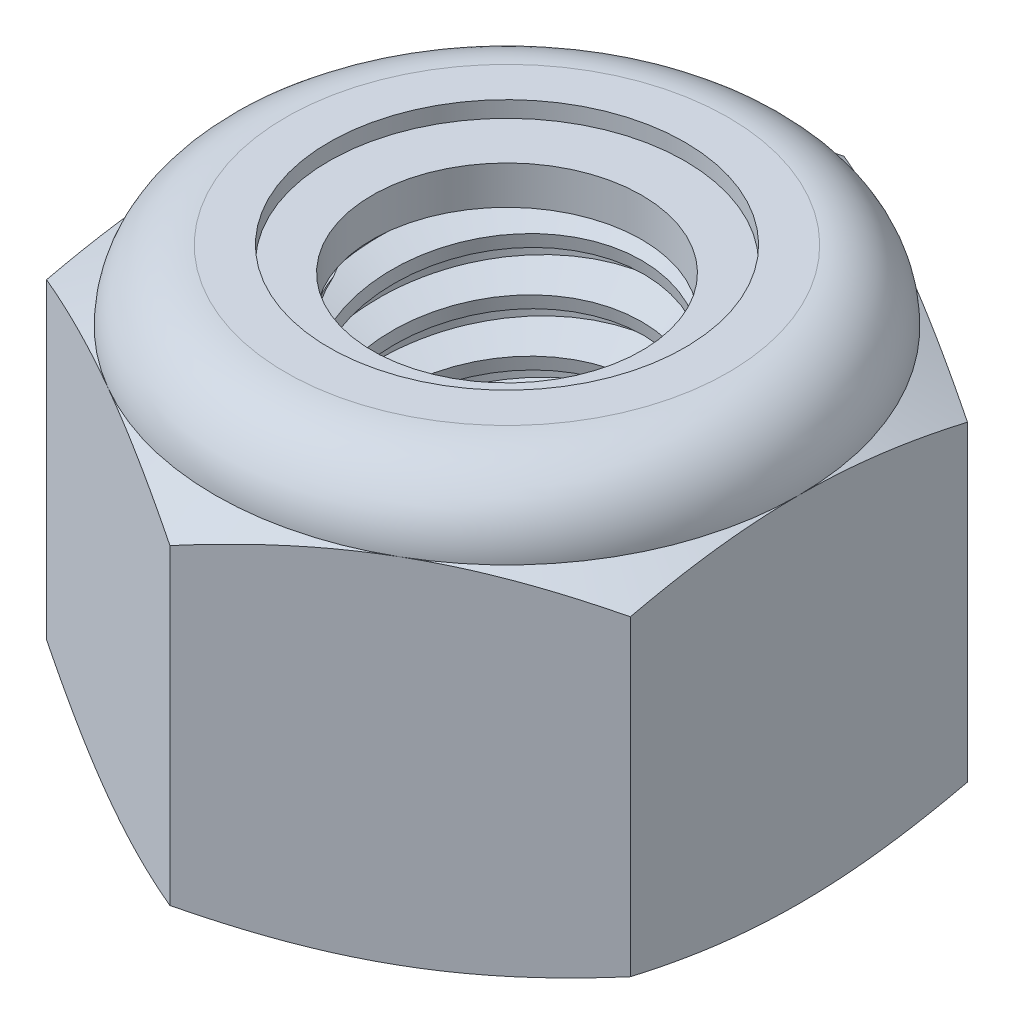
from build123d import *

# Parameters (mm, degrees)
EXTRUDE1_DEPTH      = 4
SKETCH2_W           = 1.5
SKETCH2_H           = 4
LPATTERN1_COUNT     = 8
LPATTERN1_PITCH     = 0.5
LPATTERN1_COL_COUNT = 2
LPATTERN1_COL_PITCH = 0.5


with BuildPart() as part:
    # Sketch1 → Extrude1 (new body)
    with BuildSketch(Plane(origin=(0, 0, 0), x_dir=(1, 0, 0), z_dir=(0, 1, 0))):
        Polygon((0, 3.175426481), (-2.75, 1.58771324), (-2.75, -1.58771324), (0, -3.175426481), (2.75, -1.58771324), (2.75, 1.58771324), align=None)
    extrude(amount=EXTRUDE1_DEPTH)

    # Sketch4 → Cut-Revolve2 (revolve, cut)
    with BuildSketch(Plane(origin=(0, 0, 0), x_dir=(0, 0, -1), z_dir=(1, 0, 0)), mode=Mode.PRIVATE) as cut_revolve2_sk:
        Polygon((0, 4), (1.5, 4), (1.269011592, 3.892288336), (1.269011592, 0.107711664), (1.5, 0), (0, 0), align=None)
    revolve(cut_revolve2_sk.sketch.rotate(Axis((0, 4, 0), (0, 1, 0)), 55.157981045), axis=Axis((0, 4, 0), (0, 1, 0)), mode=Mode.SUBTRACT)


with BuildPart() as body_2:
    # Sketch2 → Revolve1 (revolve)
    with BuildSketch(Plane(origin=(0, 0, 0), x_dir=(0, 0, -1), z_dir=(1, 0, 0))):
        with Locations((0.75, 2)):
            Rectangle(SKETCH2_W, SKETCH2_H)
    revolve(axis=Axis((0, -1.5, 0), (0, 1, 0)))

    # Sketch3 → Cut-Revolve1 (revolve, cut)
    with BuildSketch(Plane(origin=(0, 0, 0), x_dir=(0, 0, -1), z_dir=(1, 0, 0)), mode=Mode.PRIVATE) as cut_revolve1_sk:
        Polygon((1.510274937, 3.93835038), (1.582199494, 3.506803038), (1.289561466, 3.616435308), (1.269011592, 3.739734548), align=None)
    cut_revolve1 = revolve(cut_revolve1_sk.sketch.rotate(Axis((0, 4, 0.089188249), (0, -0.9863939238321435, -0.16439898730535837)), 180), axis=Axis((0, 4, 0.089188249), (0, -0.9863939238321435, -0.16439898730535837)), mode=Mode.SUBTRACT)

    # LPattern1: Cut-Revolve1 ×8
    with Locations(*[(0, -i * LPATTERN1_PITCH, 0) for i in range(1, LPATTERN1_COUNT)]):
        add(cut_revolve1, mode=Mode.SUBTRACT)

    # LPattern1 col: Cut-Revolve1 ×2
    with Locations(*[(0, i * LPATTERN1_COL_PITCH, 0) for i in range(1, LPATTERN1_COL_COUNT)]):
        add(cut_revolve1, mode=Mode.SUBTRACT)


with BuildPart() as part_1:
    add(part.part)

    # Combine1: cut body 2
    add(body_2.part, mode=Mode.SUBTRACT)

    # Sketch5 → Cut-Revolve3 (revolve, cut)
    with BuildSketch(Plane(origin=(0, 0, 0), x_dir=(0, 0, -1), z_dir=(1, 0, 0)), mode=Mode.PRIVATE) as cut_revolve3_sk:
        with BuildLine():
            Line((0, 0), (2.75, 0))
            Line((2.75, 0), (3.175426481, 0.198379626))
            Line((3.175426481, 0.198379626), (3.175426481, 3.134953707))
            Line((3.175426481, 3.134953707), (2.75, 3.333333333))
            ThreePointArc((2.75, 3.333333333), (2.554737854, 3.804737854), (2.083333333, 4))
            Line((2.083333333, 4), (2.083333333, 5.27))
            Line((2.083333333, 5.27), (4.445426481, 5.27))
            Line((4.445426481, 5.27), (4.445426481, -1.27))
            Line((4.445426481, -1.27), (0, -1.27))
            Line((0, -1.27), (0, 0))
        make_face()
    revolve(cut_revolve3_sk.sketch.rotate(Axis((0, 0, 0), (0, 1, 0)), 55.157981045), axis=Axis((0, 0, 0), (0, 1, 0)), mode=Mode.SUBTRACT)

    # Sketch6 → Cut-Revolve4 (revolve, cut)
    with BuildSketch(Plane(origin=(0, 0, 0), x_dir=(0, 0, -1), z_dir=(1, 0, 0)), mode=Mode.PRIVATE) as cut_revolve4_sk:
        with BuildLine():
            Line((0, 3.333333333), (2.5976, 3.333333333))
            ThreePointArc((2.5976, 3.333333333), (2.446974781, 3.696974781), (2.083333333, 3.8476))
            Line((2.083333333, 3.8476), (1.676172463, 3.8476))
            Line((1.676172463, 3.8476), (1.676172463, 5.27))
            Line((1.676172463, 5.27), (0, 5.27))
            Line((0, 5.27), (0, 3.333333333))
        make_face()
    revolve(cut_revolve4_sk.sketch.rotate(Axis((0, 5.27, 0), (0, 1, 0)), 55.157981045), axis=Axis((0, 5.27, 0), (0, 1, 0)), mode=Mode.SUBTRACT)


with BuildPart() as body_2_2:
    # Sketch7 → Revolve2 (revolve)
    with BuildSketch(Plane(origin=(0, 0, 0), x_dir=(0, 0, -1), z_dir=(1, 0, 0))):
        with BuildLine():
            Line((1.269011592, 3.409533333), (2.514721748, 3.409533333))
            ThreePointArc((2.514721748, 3.409533333), (2.36486639, 3.668954462), (2.083333333, 3.7714))
            Line((2.083333333, 3.7714), (1.269011592, 3.7714))
            Line((1.269011592, 3.7714), (1.269011592, 3.409533333))
        make_face()
    revolve(axis=Axis((0, 3.409533333, 0), (0, 1, 0)))


solid = Compound([part_1.part, body_2_2.part])
